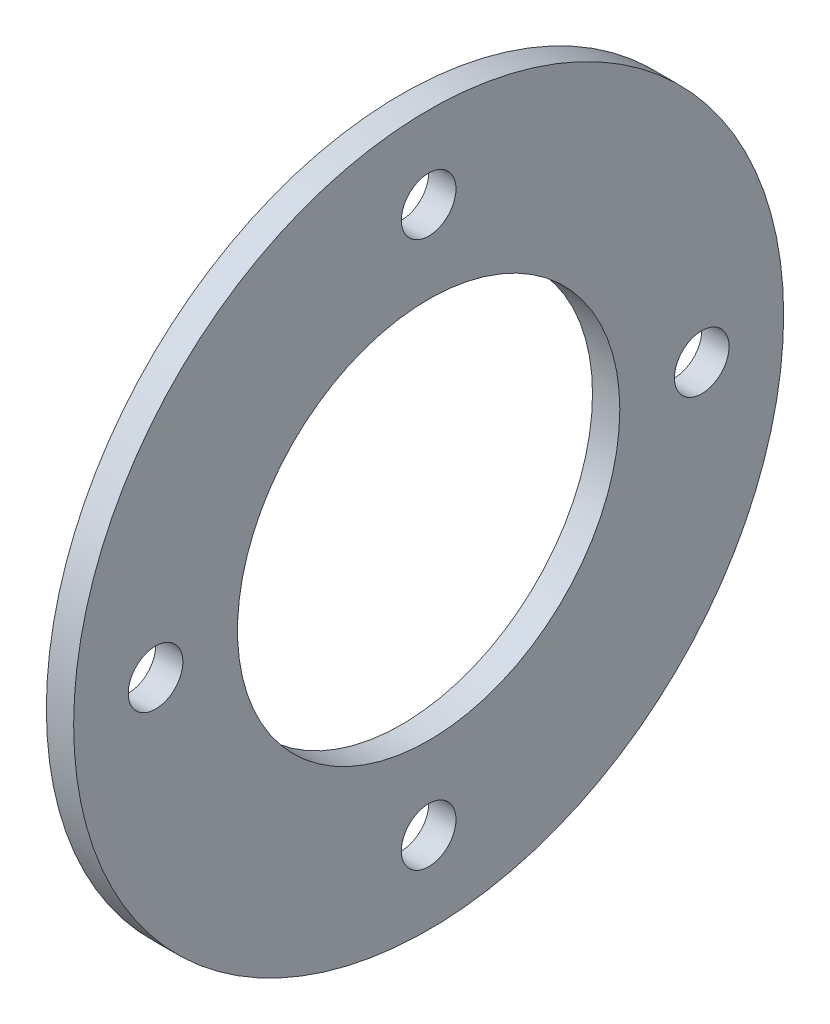
from build123d import *

# Parameters (mm, degrees)
SKETCH1_R           = 26
SKETCH1_R_2         = 14
SKETCH1_R_3         = 2
BOSS_EXTRUDE1_DEPTH = 2


with BuildPart() as part:
    # Sketch1 → Boss-Extrude1 (new body)
    with BuildSketch(Plane(origin=(0, 0, 0), x_dir=(0, 0, -1), z_dir=(1, 0, 0))):
        Circle(SKETCH1_R)
        Circle(SKETCH1_R_2, mode=Mode.SUBTRACT)
        with Locations((0, 20)):
            Circle(SKETCH1_R_3, mode=Mode.SUBTRACT)
        with Locations((20, 0)):
            Circle(SKETCH1_R_3, mode=Mode.SUBTRACT)
        with Locations((0, -20)):
            Circle(SKETCH1_R_3, mode=Mode.SUBTRACT)
        with Locations((-20, 0)):
            Circle(SKETCH1_R_3, mode=Mode.SUBTRACT)
    extrude(amount=BOSS_EXTRUDE1_DEPTH)


solid = part.part
